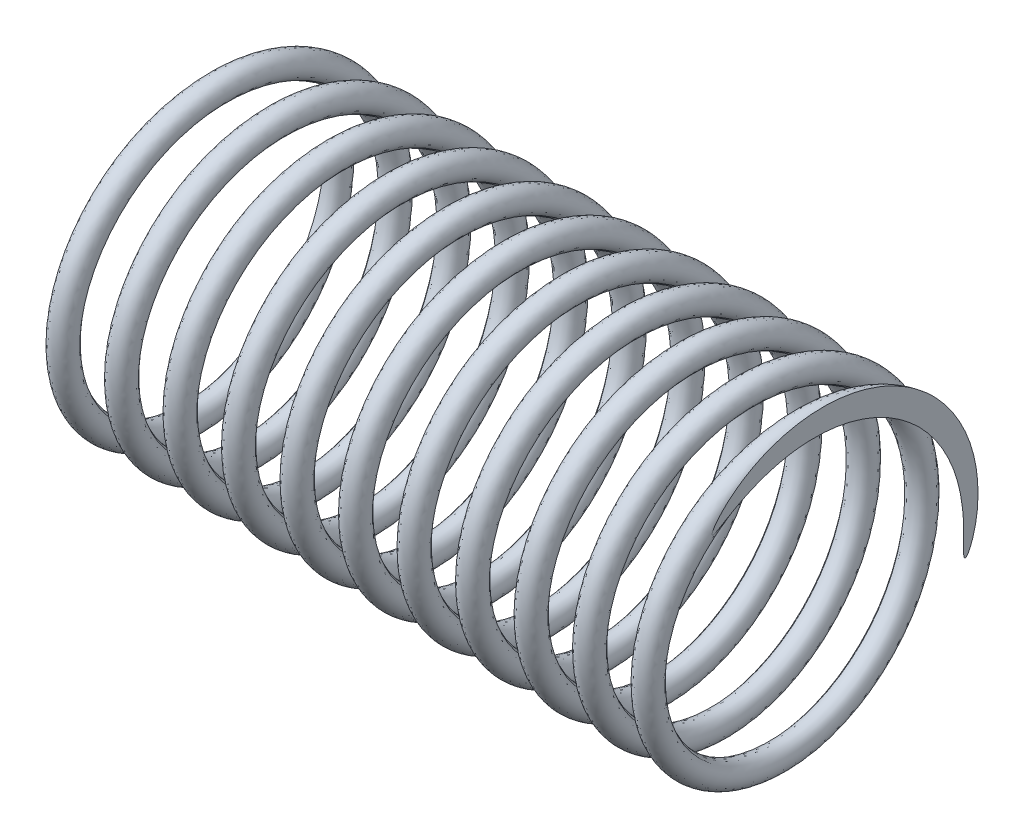
from build123d import *

# Parameters (mm, degrees)
SWEEP1_PITCH            = 1.2
SWEEP1_HEIGHT           = 26
SWEEP1_RADIUS           = 3.1
SWEEP1_START_ANGLE      = 180
SKETCH2_R               = 0.25
CUT_EXTRUDE1_DEPTH      = 27.674099052
CUT_EXTRUDE1_DEPTH_BACK = 27.674099052
SKETCH3_W               = 45
SKETCH3_H               = 12.96047702
SKETCH3_W_2             = 1.428371213
SKETCH3_H_2             = 11.263142182


with BuildPart() as part:
    # Sweep1: sweep along a helix
    with BuildLine() as sweep1_path:
        add(Helix(SWEEP1_PITCH, SWEEP1_HEIGHT, SWEEP1_RADIUS, center=(0, 0, 0), direction=(1, 0, 0), lefthand=True, mode=Mode.PRIVATE).rotate(Axis((0, 0, 0), (1, 0, 0)), SWEEP1_START_ANGLE))
    # Sketch2 → Sweep1 (sweep)
    with BuildSketch(Plane(origin=(0, 0, 0), x_dir=(1, 0, 0), z_dir=(0, 1, 0))):
        with Locations((0, 3.1)):
            Circle(SKETCH2_R)
    sweep(path=sweep1_path.line, is_frenet=True)

    # Sketch3 → Cut-Extrude1 (cut, two sides: drawn at the far end of the back side and taken through both)
    with BuildSketch(Plane.XY.offset(-CUT_EXTRUDE1_DEPTH_BACK)):
        with Locations((35.5, 0)):
            Rectangle(SKETCH3_W, SKETCH3_H)
        with Locations((-0.714185607, -0.848667419)):
            Rectangle(SKETCH3_W_2, SKETCH3_H_2)
    extrude(amount=CUT_EXTRUDE1_DEPTH + CUT_EXTRUDE1_DEPTH_BACK, mode=Mode.SUBTRACT)


solid = part.part
